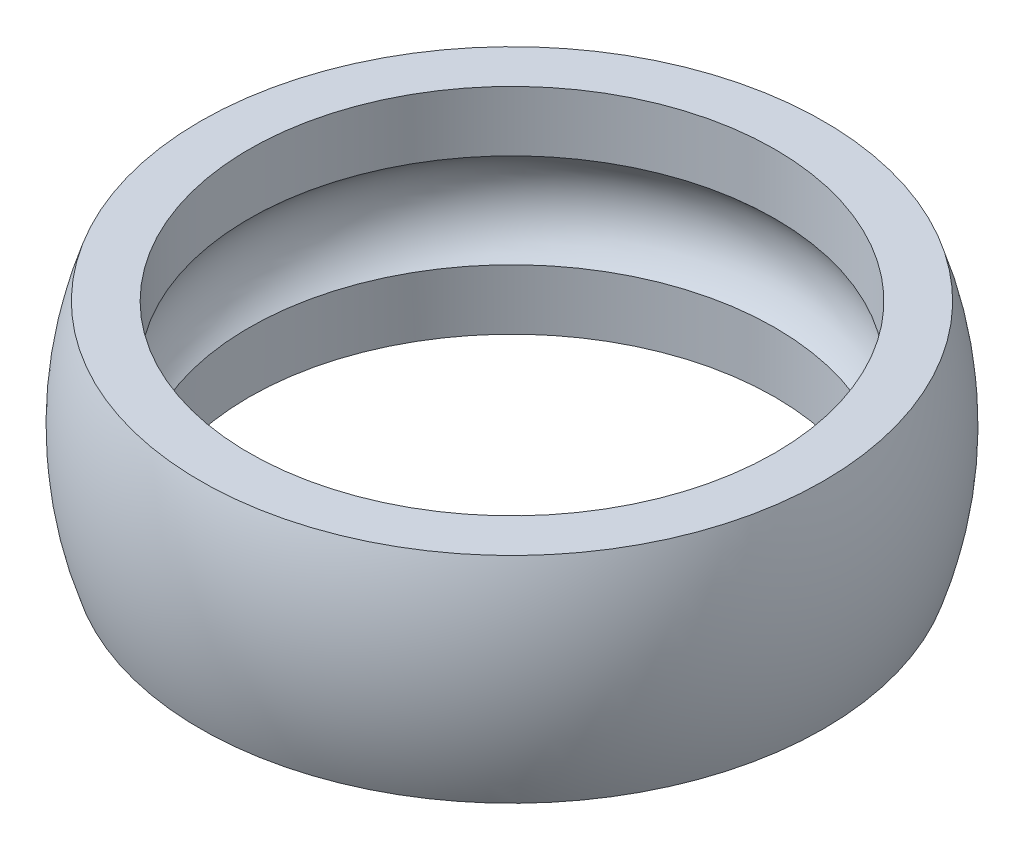
from build123d import *

# Parameters (mm, degrees)
CUT_EXTRUDE1_DEPTH      = 16.720209922
CUT_EXTRUDE1_DEPTH_BACK = 16.720209922
SKETCH3_W               = 21.5
SKETCH3_H               = 0.5


with BuildPart() as part:
    # Sketch2 → Revolve1 (revolve)
    with BuildSketch(Plane.XY):
        with BuildLine():
            Line((8.578101022, -1.538329541), (8.578101022, -4))
            Line((8.578101022, -4), (9.978101022, -4))
            ThreePointArc((9.978101022, -4), (10.75, 0), (9.978101022, 4))
            Line((9.978101022, 4), (8.578101022, 4))
            Line((8.578101022, 4), (8.578101022, 1.538329541))
            ThreePointArc((8.578101022, 1.538329541), (9.110552684, 0.849646384), (9.3, 0))
            ThreePointArc((9.3, 0), (9.110552684, -0.849646384), (8.578101022, -1.538329541))
        make_face()
    revolve(axis=Axis((0, 0, 0), (0, 1, 0)))

    # Sketch3 → Cut-Extrude1 (cut, two sides: drawn at the far end of the back side and taken through both)
    with BuildSketch(Plane.XY.offset(-CUT_EXTRUDE1_DEPTH_BACK)):
        with Locations((0, 3.75)):
            Rectangle(SKETCH3_W, SKETCH3_H)
        with Locations((0, -3.75)):
            Rectangle(SKETCH3_W, SKETCH3_H)
    extrude(amount=CUT_EXTRUDE1_DEPTH + CUT_EXTRUDE1_DEPTH_BACK, mode=Mode.SUBTRACT)


solid = part.part
